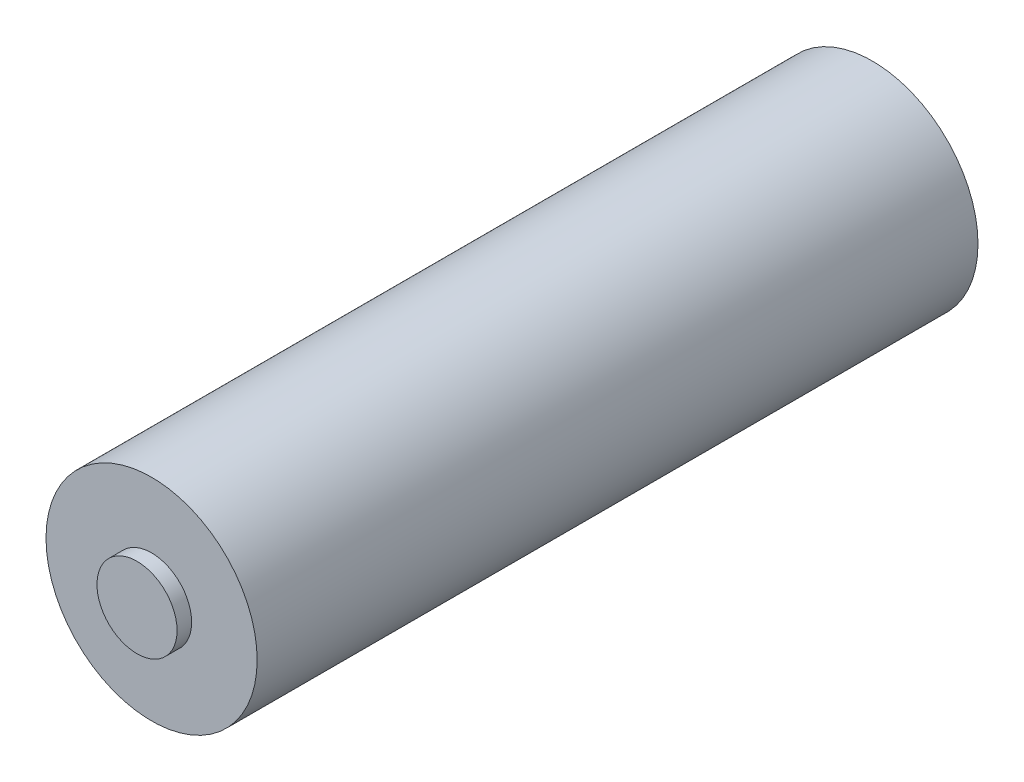
from build123d import *

# Parameters (mm, degrees)
SKETCH1_R           = 7.25
SKETCH1_R_2         = 2.75
BOSS_EXTRUDE1_DEPTH = 49.5
SKETCH1_2_R         = 2.75
BOSS_EXTRUDE2_DEPTH = 50.5


with BuildPart() as part:
    # Sketch1 → Boss-Extrude1 (new body)
    with BuildSketch(Plane.XY):
        Circle(SKETCH1_R)
        Circle(SKETCH1_R_2, mode=Mode.SUBTRACT)
    extrude(amount=BOSS_EXTRUDE1_DEPTH)

    # Sketch1<2> → Boss-Extrude2 (add)
    with BuildSketch(Plane.XY):
        Circle(SKETCH1_2_R)
    extrude(amount=BOSS_EXTRUDE2_DEPTH)


solid = part.part
